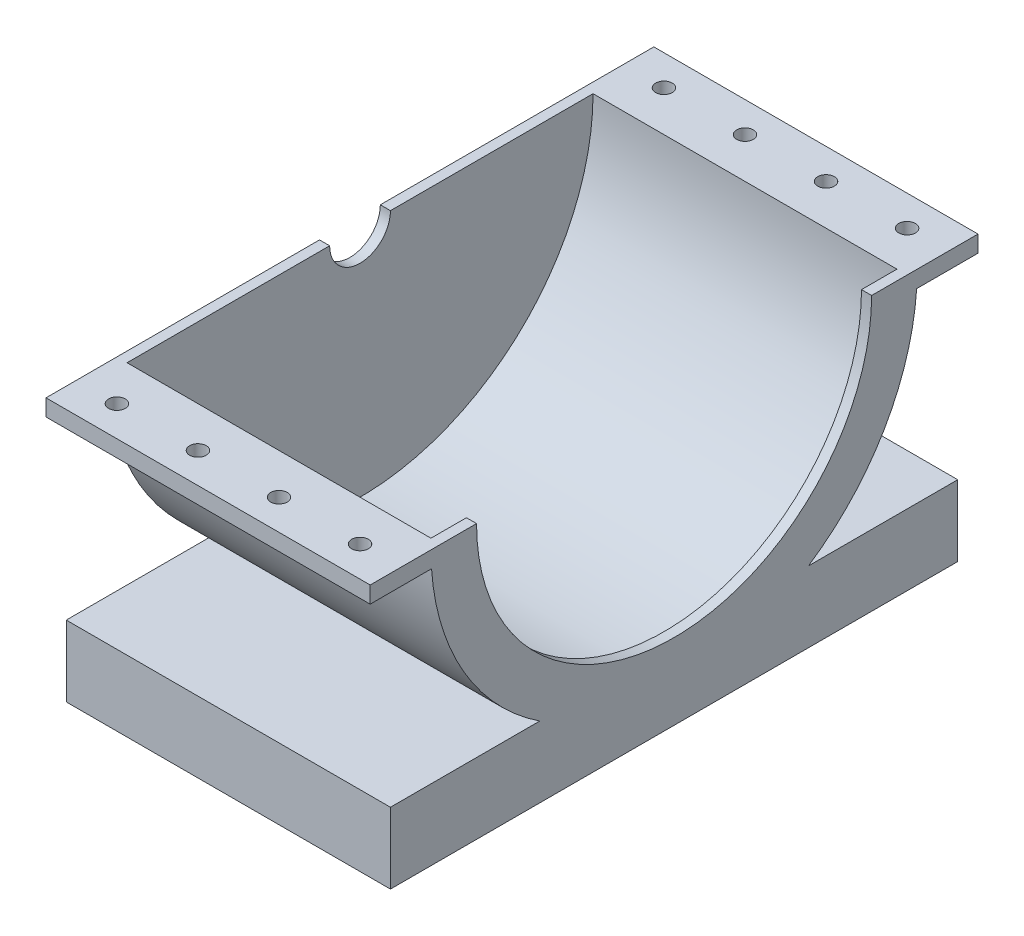
from build123d import *

# Parameters (mm, degrees)
BOSS_EXTRUDE1_DEPTH  = 4
SKETCH2_R            = 5.75
CUT_EXTRUDE1_DEPTH   = 3.75
SKETCH5_R            = 0.205
CUT_EXTRUDE2_DEPTH   = 0.41
LPATTERN1_COUNT      = 4
LPATTERN1_PITCH      = 2
LPATTERN1_COUNT_DIR2 = 2
LPATTERN1_PITCH_DIR2 = 13.5
CUT_EXTRUDE3_DEPTH   = 13.440483311
CUT_EXTRUDE4_REACH   = 14.44
SKETCH6_3_R          = 4.875
SKETCH6_3_R_2        = 0.75
SCALE1_SCALE         = 25.4


with BuildPart() as part:
    # Sketch1 → Boss-Extrude1 (new, symmetric)
    with BuildSketch(Plane(origin=(0, 0, 0), x_dir=(0, 0, -1), z_dir=(1, 0, 0))):
        with BuildLine():
            Line((-7, 0.875), (-7, -0.875))
            Line((-7, -0.875), (7, -0.875))
            Line((7, -0.875), (7, 0.875))
            Line((7, 0.875), (3.31662479, 0.875))
            ThreePointArc((3.31662479, 0.875), (5.186676874, 2.858647401), (5.985975276, 5.465))
            Line((5.985975276, 5.465), (7.5, 5.465))
            Line((7.5, 5.465), (7.5, 5.875))
            Line((7.5, 5.875), (-7.5, 5.875))
            Line((-7.5, 5.875), (-7.5, 5.465))
            Line((-7.5, 5.465), (-5.985975276, 5.465))
            ThreePointArc((-5.985975276, 5.465), (-5.186676874, 2.858647401), (-3.31662479, 0.875))
            Line((-3.31662479, 0.875), (-7, 0.875))
        make_face()
    extrude(amount=BOSS_EXTRUDE1_DEPTH, both=True)

    # Sketch2 → Cut-Extrude1 (cut, symmetric)
    with BuildSketch(Plane(origin=(0, 0, 0), x_dir=(0, 0, -1), z_dir=(1, 0, 0))):
        with Locations((0, 5.875)):
            Circle(SKETCH2_R)
    extrude(amount=CUT_EXTRUDE1_DEPTH, both=True, mode=Mode.SUBTRACT)

    # Sketch5 → Cut-Extrude2 (cut)
    with BuildSketch(Plane(origin=(0, 5.875, 0), x_dir=(1, 0, 0), z_dir=(0, 1, 0))):
        with Locations(Location((-3, 6.75, 0), (0, 0, 270))):
            Circle(SKETCH5_R)
    cut_extrude2 = extrude(amount=-CUT_EXTRUDE2_DEPTH, mode=Mode.SUBTRACT)

    # LPattern1: Cut-Extrude2 4 × 2
    with Locations(*[(i * LPATTERN1_PITCH, 0, j * LPATTERN1_PITCH_DIR2) for i in range(LPATTERN1_COUNT) for j in range(LPATTERN1_COUNT_DIR2) if (i, j) != (0, 0)]):
        add(cut_extrude2, mode=Mode.SUBTRACT)

    # Sketch6 → Cut-Extrude3 (cut, through all)
    with BuildSketch(Plane(origin=(4, 0, 0), x_dir=(0, 0, -1), z_dir=(1, 0, 0))):
        with BuildLine():
            Line((-0.75, 5.875), (0.75, 5.875))
            ThreePointArc((0.75, 5.875), (0, 6.625), (-0.75, 5.875))
        make_face()
        with BuildLine():
            ThreePointArc((-0.75, 5.875), (0, 5.125), (0.75, 5.875))
            Line((0.75, 5.875), (-0.75, 5.875))
        make_face()
    extrude(amount=-CUT_EXTRUDE3_DEPTH, mode=Mode.SUBTRACT)

    # Sketch6<3> → Cut-Extrude4 (cut, up to next)
    with BuildSketch(Plane(origin=(4, 0, 0), x_dir=(0, 0, -1), z_dir=(1, 0, 0)), mode=Mode.PRIVATE) as cut_extrude4_sk1:
        with Locations((0, 5.875)):
            Circle(SKETCH6_3_R)
        with Locations((0, 5.875)):
            Circle(SKETCH6_3_R_2, mode=Mode.SUBTRACT)
    cut_extrude4_tool1 = extrude(cut_extrude4_sk1.sketch, amount=-CUT_EXTRUDE4_REACH, mode=Mode.PRIVATE) & part.part
    add(cut_extrude4_tool1.solids().sort_by_distance((4, 5.875, 4.737114))[0], mode=Mode.SUBTRACT)


with BuildPart() as part_1:
    # Scale1: scaled about (-0.158509588, 0.753010739, 0)
    add(part.part.scale(SCALE1_SCALE).moved(Location((3.867633947, -18.373462032, 0))))


solid = part_1.part
